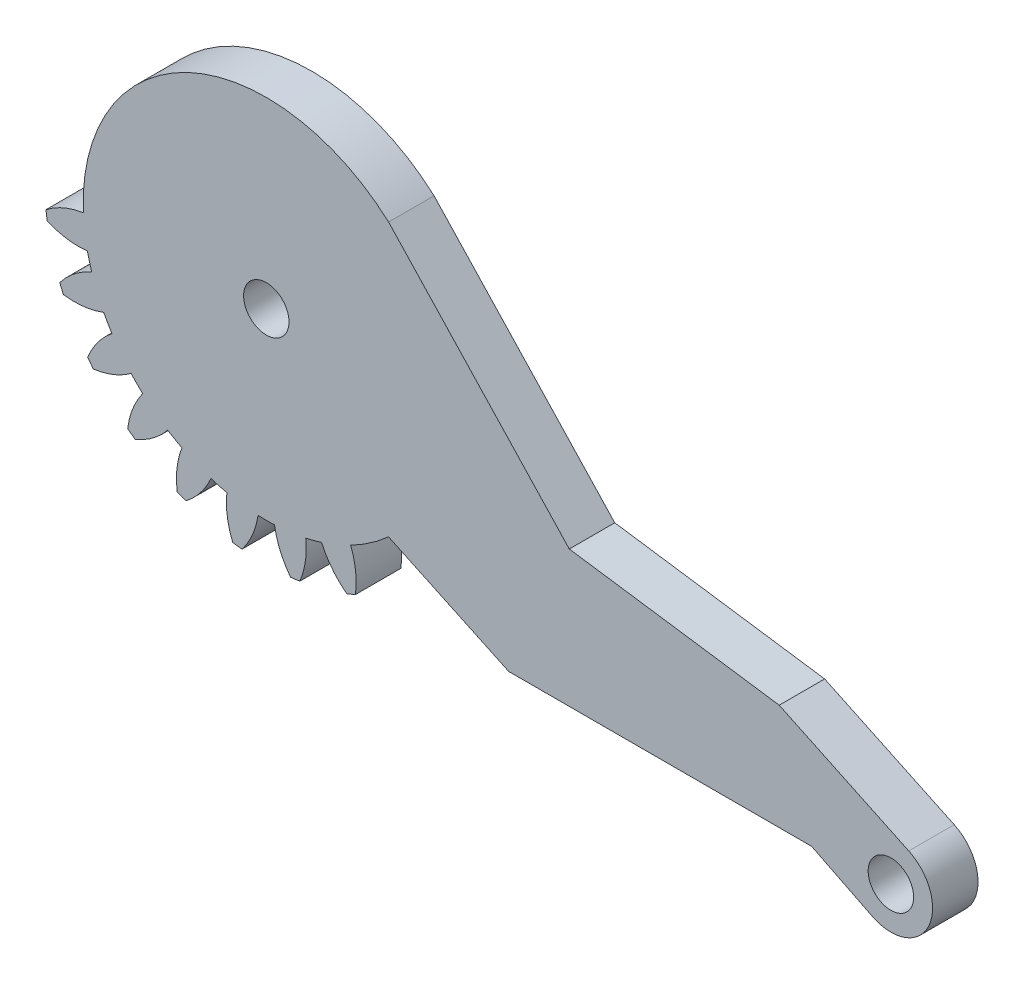
from build123d import *

# Parameters (mm, degrees)
SKETCH2_R           = 1.5
BOSS_EXTRUDE2_DEPTH = 3


with BuildPart() as part:
    # Sketch2 → Boss-Extrude2 (new body)
    with BuildSketch(Plane.XY):
        with BuildLine():
            Line((33.856406461, -4.911436862), (20, -2.911436862))
            Line((20, -2.911436862), (8.072676136, 9.818872958))
            ThreePointArc((8.072676136, 9.818872958), (-5.173839679, 11.745880003), (-12.077884766, 0.277763382))
            ThreePointArc((-12.077884766, 0.277763382), (-13.37688471, -0.097129684), (-14.542044827, -0.782948586))
            ThreePointArc((-14.542044827, -0.782948586), (-14.504838322, -1.090725234), (-14.461118588, -1.3976444))
            ThreePointArc((-14.461118588, -1.3976444), (-13.158157346, -1.758528961), (-11.806390286, -1.78444193))
            ThreePointArc((-11.806390286, -1.78444193), (-11.67804324, -2.310249297), (-11.526291359, -2.829785359))
            ThreePointArc((-11.526291359, -2.829785359), (-12.683999488, -3.528110178), (-13.631954743, -4.492125996))
            ThreePointArc((-13.631954743, -4.492125996), (-13.516357561, -4.779785658), (-13.394691015, -5.064931306))
            ThreePointArc((-13.394691015, -5.064931306), (-12.042723303, -5.076287839), (-10.73030982, -4.751454786))
            ThreePointArc((-10.73030982, -4.751454786), (-10.470247132, -5.226127042), (-10.189200244, -5.688684064))
            ThreePointArc((-10.189200244, -5.688684064), (-11.126720661, -6.662850955), (-11.792869471, -7.839367605))
            ThreePointArc((-11.792869471, -7.839367605), (-11.606759368, -8.087306749), (-11.415437385, -8.331246676))
            ThreePointArc((-11.415437385, -8.331246676), (-10.106597569, -7.992301252), (-8.922976471, -7.338859012))
            ThreePointArc((-8.922976471, -7.338859012), (-8.548920985, -7.730048027), (-8.15773197, -8.104103513))
            ThreePointArc((-8.15773197, -8.104103513), (-8.81117421, -9.287724611), (-9.150119633, -10.596564427))
            ThreePointArc((-9.150119633, -10.596564427), (-8.906179706, -10.787886411), (-8.658240563, -10.973996513))
            ThreePointArc((-8.658240563, -10.973996513), (-7.481723913, -10.307847704), (-6.507557022, -9.370327286))
            ThreePointArc((-6.507557022, -9.370327286), (-6.045, -9.651374174), (-5.570327744, -9.911436862))
            ThreePointArc((-5.570327744, -9.911436862), (-5.895160797, -11.223850345), (-5.883804264, -12.575818057))
            ThreePointArc((-5.883804264, -12.575818057), (-5.598658616, -12.697484603), (-5.310998954, -12.813081785))
            ThreePointArc((-5.310998954, -12.813081785), (-4.346983136, -11.86512653), (-3.648658316, -10.707418401))
            ThreePointArc((-3.648658316, -10.707418401), (-3.129122255, -10.859170282), (-2.603314888, -10.987517329))
            ThreePointArc((-2.603314888, -10.987517329), (-2.577401919, -12.339284388), (-2.216517358, -13.64224563))
            ThreePointArc((-2.216517358, -13.64224563), (-1.909598192, -13.685965364), (-1.601821544, -13.723171869))
            ThreePointArc((-1.601821544, -13.723171869), (-0.916002642, -12.558011752), (-0.541109576, -11.259011808))
            ThreePointArc((-0.541109576, -11.259011808), (0, -11.271127042), (0.541109576, -11.259011808))
            ThreePointArc((0.541109576, -11.259011808), (0.916002642, -12.558011752), (1.601821544, -13.723171869))
            ThreePointArc((1.601821544, -13.723171869), (1.909598192, -13.685965364), (2.216517358, -13.64224563))
            ThreePointArc((2.216517358, -13.64224563), (2.577401919, -12.339284388), (2.603314888, -10.987517329))
            ThreePointArc((2.603314888, -10.987517329), (3.129122255, -10.859170282), (3.648658316, -10.707418401))
            ThreePointArc((3.648658316, -10.707418401), (4.346983136, -11.86512653), (5.310998954, -12.813081785))
            ThreePointArc((5.310998954, -12.813081785), (5.598658616, -12.697484603), (5.883804264, -12.575818057))
            ThreePointArc((5.883804264, -12.575818057), (5.895160797, -11.223850345), (5.570327744, -9.911436862))
            ThreePointArc((5.570327744, -9.911436862), (6.876145849, -9.125307162), (8.072676136, -8.181127042))
            Line((8.072676136, -8.181127042), (16, -11.911436862))
            Line((16, -11.911436862), (36, -11.911436862))
            Line((36, -11.911436862), (40, -13.911436862))
            ThreePointArc((40, -13.911436862), (43.70240259, -12.65581862), (42.40824957, -8.966708962))
            Line((42.40824957, -8.966708962), (33.856406461, -4.911436862))
        make_face()
        with Locations((41.229904242, -11.451628378)):
            Circle(SKETCH2_R, mode=Mode.SUBTRACT)
        with Locations((0, 0.818872958)):
            Circle(SKETCH2_R, mode=Mode.SUBTRACT)
    extrude(amount=BOSS_EXTRUDE2_DEPTH)


solid = part.part
